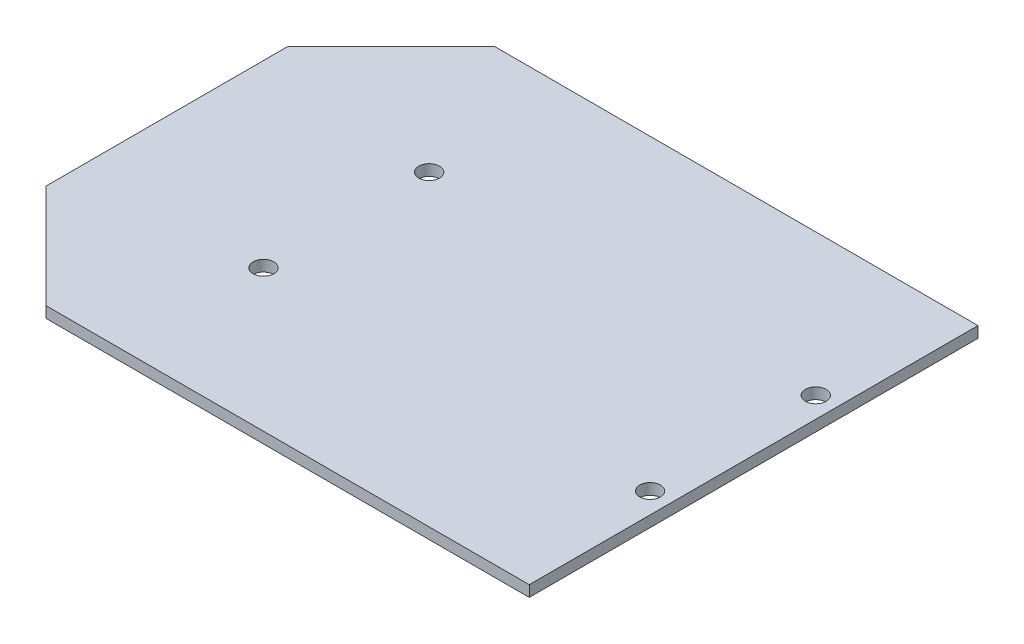
from build123d import *

# Parameters (mm, degrees)
SKETCH1_W           = 85
SKETCH1_H           = 65
BOSS_EXTRUDE1_DEPTH = 1.6
CUT_EXTRUDE1_DEPTH  = 10
SKETCH4_R           = 1.5
CUT_EXTRUDE2_DEPTH  = 16


with BuildPart() as part:
    # Sketch1 → Boss-Extrude1 (new body)
    with BuildSketch(Plane(origin=(0, 0, 0), x_dir=(1, 0, 0), z_dir=(0, 1, 0))):
        Rectangle(SKETCH1_W, SKETCH1_H)
    extrude(amount=BOSS_EXTRUDE1_DEPTH)

    # Sketch3 → Cut-Extrude1 (cut)
    with BuildSketch(Plane(origin=(0, 0, 0), x_dir=(-1, 0, 0), z_dir=(0, -1, 0))):
        Polygon((42.5, 32.5), (42.5, 17.5), (27.5, 32.5), align=None)
        Polygon((27.5, -32.5), (42.5, -32.5), (42.5, -17.5), align=None)
    extrude(amount=-CUT_EXTRUDE1_DEPTH, mode=Mode.SUBTRACT)

    # Sketch4 → Cut-Extrude2 (cut)
    with BuildSketch(Plane(origin=(0, 0, 0), x_dir=(-1, 0, 0), z_dir=(0, -1, 0))):
        with Locations(Location((16.5, -12, 0), (0, 0, 90))):
            Circle(SKETCH4_R)
        with Locations(Location((16.5, 12, 0), (0, 0, 90))):
            Circle(SKETCH4_R)
        with Locations(Location((-39.5, -12, 0), (0, 0, 90))):
            Circle(SKETCH4_R)
        with Locations(Location((-39.5, 12, 0), (0, 0, 90))):
            Circle(SKETCH4_R)
    extrude(amount=-CUT_EXTRUDE2_DEPTH, mode=Mode.SUBTRACT)


solid = part.part
